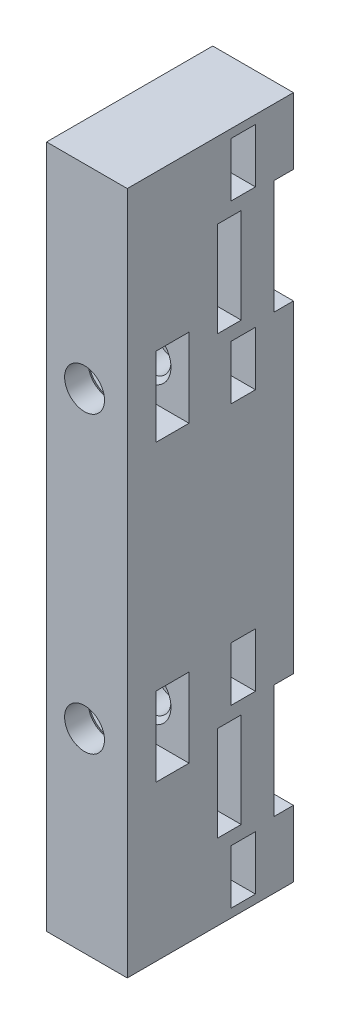
from build123d import *

# Parameters (mm, degrees)
ESQUISSE1_W             = 8.5
ESQUISSE1_H             = 72
ESQUISSE1_R             = 2.1
BOSS_EXTRU_1_DEPTH      = 17.5
ENL_V_START             = -3
ENL_V_MAT_EXTRU_4_DEPTH = 3.5
ESQUISSE7_R             = 2.1
BOSS_EXTRU_3_DEPTH      = 8
ESQUISSE3_W             = 8.5
ESQUISSE3_H             = 4
ENL_V_MAT_EXTRU_3_DEPTH = 19
BOSS_EXTRU_2_START      = -7
BOSS_EXTRU_2_DEPTH      = 12
ESQUISSE8_W             = 8.5
ESQUISSE8_H             = 7
BOSS_EXTRU_4_DEPTH      = 4
ESQUISSE9_R             = 1.6
ENL_V_MAT_EXTRU_5_DEPTH = 5
ENL_V_START_2           = -4
ESQUISSE10_R            = 1.6
ENL_V_MAT_EXTRU_6_DEPTH = 2.6
ESQUISSE11_R            = 1.6
ENL_V_MAT_EXTRU_7_DEPTH = 1.6
ESQUISSE14_W            = 2.5
ESQUISSE14_H            = 10
ENL_V_MAT_EXTRU_9_DEPTH = 17.6
CHANFREIN1_SIZE         = 0.5


with BuildPart() as part:
    # Esquisse1 → Boss.-Extru.1 (new body)
    with BuildSketch(Plane.XY):
        with Locations((4.25, 36)):
            Rectangle(ESQUISSE1_W, ESQUISSE1_H)
        with Locations((4, 20.5)):
            Circle(ESQUISSE1_R, mode=Mode.SUBTRACT)
        with Locations((4, 51.5)):
            Circle(ESQUISSE1_R, mode=Mode.SUBTRACT)
    extrude(amount=BOSS_EXTRU_1_DEPTH)

    # Esquisse6 → Enlèv. mat.-Extru.4 (cut)
    with BuildSketch(Plane.XY.offset(17.5).offset(ENL_V_START)):
        Polygon((7.6, 22.578460969), (4, 24.656921938), (0.4, 22.578460969), (0.4, 18.421539031), (4, 16.343078062), (7.6, 18.421539031), align=None)
        Polygon((8.5, 24.656921938), (4, 24.656921938), (7.6, 22.578460969), (7.6, 18.421539031), (4, 16.343078062), (8.5, 16.343078062), align=None)
    enl_v_mat_extru_4 = extrude(amount=-ENL_V_MAT_EXTRU_4_DEPTH, mode=Mode.SUBTRACT)

    # Esquisse7 → Boss.-Extru.3 (add)
    with BuildSketch(Plane(origin=(0, 0, 0), x_dir=(-1, 0, 0), z_dir=(0, 0, -1))):
        with Locations((-4, 20.5)):
            Circle(ESQUISSE7_R)
    boss_extru_3 = extrude(amount=-BOSS_EXTRU_3_DEPTH)

    # Esquisse3 → Enlèv. mat.-Extru.3 (cut)
    with BuildSketch(Plane(origin=(0, 0, 0), x_dir=(-1, 0, 0), z_dir=(0, -1, 0))):
        with Locations((-4.25, -2)):
            Rectangle(ESQUISSE3_W, ESQUISSE3_H)
    enl_v_mat_extru_3 = extrude(amount=-ENL_V_MAT_EXTRU_3_DEPTH, mode=Mode.SUBTRACT)

    # Esquisse5 → Boss.-Extru.2 (add)
    with BuildSketch(Plane.XZ.offset(BOSS_EXTRU_2_START)):
        with BuildLine():
            ThreePointArc((4.662966643, 2.165487935), (4.682946936, 2.27184931), (4.714353535, 2.375413685))
            ThreePointArc((4.714353535, 2.375413685), (5.229781903, 2.78475984), (5.773646598, 2.414028307))
            ThreePointArc((5.773646598, 2.414028307), (5.814751932, 2.291920009), (5.839789089, 2.165534781))
            ThreePointArc((5.839789089, 2.165534781), (5.889607538, 2.072347427), (5.988503907, 2.035128225))
            Line((5.988503907, 2.035128225), (6.514258005, 2.035128225))
            ThreePointArc((6.514258005, 2.035128225), (6.613136609, 2.072331852), (6.662966643, 2.165487935))
            ThreePointArc((6.662966643, 2.165487935), (6.682946936, 2.27184931), (6.714353535, 2.375413685))
            ThreePointArc((6.714353535, 2.375413685), (7.229781903, 2.78475984), (7.773646598, 2.414028307))
            ThreePointArc((7.773646598, 2.414028307), (7.814751932, 2.291920009), (7.839789089, 2.165534781))
            ThreePointArc((7.839789089, 2.165534781), (7.889607538, 2.072347427), (7.988503907, 2.035128225))
            Line((7.988503907, 2.035128225), (8.5, 2.035128225))
            Line((8.5, 2.035128225), (8.5, 4))
            Line((8.5, 4), (0, 4))
            Line((0, 4), (0, 2.035128225))
            Line((0, 2.035128225), (0.514258005, 2.035128225))
            ThreePointArc((0.514258005, 2.035128225), (0.61313661, 2.072331853), (0.662966644, 2.165487937))
            ThreePointArc((0.662966644, 2.165487937), (0.682946936, 2.271849312), (0.714353535, 2.375413685))
            ThreePointArc((0.714353535, 2.375413685), (1.229781903, 2.78475984), (1.773646598, 2.414028307))
            ThreePointArc((1.773646598, 2.414028307), (1.814751932, 2.291920009), (1.839789089, 2.165534781))
            ThreePointArc((1.839789089, 2.165534781), (1.889607538, 2.072347427), (1.988503907, 2.035128225))
            Line((1.988503907, 2.035128225), (2.514258006, 2.035128225))
            ThreePointArc((2.514258006, 2.035128225), (2.613136611, 2.072331854), (2.662966644, 2.16548794))
            ThreePointArc((2.662966644, 2.16548794), (2.682946936, 2.271849313), (2.714353535, 2.375413685))
            ThreePointArc((2.714353535, 2.375413685), (3.229781903, 2.78475984), (3.773646598, 2.414028307))
            ThreePointArc((3.773646598, 2.414028307), (3.814751932, 2.291920009), (3.839789089, 2.165534781))
            ThreePointArc((3.839789089, 2.165534781), (3.889607538, 2.072347427), (3.988503907, 2.035128225))
            Line((3.988503907, 2.035128225), (4.514258005, 2.035128225))
            ThreePointArc((4.514258005, 2.035128225), (4.613136609, 2.072331852), (4.662966643, 2.165487935))
        make_face()
    boss_extru_2 = extrude(amount=-BOSS_EXTRU_2_DEPTH)

    # Esquisse8 → Boss.-Extru.4 (add)
    with BuildSketch(Plane(origin=(0, 0, 4), x_dir=(-1, 0, 0), z_dir=(0, 0, -1))):
        with Locations((-4.25, 3.5)):
            Rectangle(ESQUISSE8_W, ESQUISSE8_H)
    boss_extru_4 = extrude(amount=BOSS_EXTRU_4_DEPTH)

    # Esquisse9 → Enlèv. mat.-Extru.5 (cut)
    with BuildSketch(Plane(origin=(0, 0, 0), x_dir=(-1, 0, 0), z_dir=(0, 0, -1))):
        with Locations((-4.25, 3.75)):
            Circle(ESQUISSE9_R)
        with Locations((-4.25, 22.25)):
            Circle(ESQUISSE9_R)
    enl_v_mat_extru_5 = extrude(amount=-ENL_V_MAT_EXTRU_5_DEPTH, mode=Mode.SUBTRACT)

    # Esquisse10 → Enlèv. mat.-Extru.6 (cut)
    # profile 1 of 4: a face of its own
    with BuildSketch(Plane(origin=(0, 0, 0), x_dir=(-1, 0, 0), z_dir=(0, 0, -1)).offset(ENL_V_START_2)):
        Polygon((-2.604551733, 25.1), (-5.895448267, 25.1), (-7.540896534, 22.25), (-5.895448267, 19.4), (-2.604551733, 19.4), (-0.959103466, 22.25), align=None)
        with Locations((-4.25, 22.25)):
            Circle(ESQUISSE10_R, mode=Mode.SUBTRACT)
    # profile 2 of 4: a face of its own
    with BuildSketch(Plane(origin=(0, 0, 0), x_dir=(-1, 0, 0), z_dir=(0, 0, -1)).offset(ENL_V_START_2)):
        Polygon((-2.604551733, 6.6), (-5.895448267, 6.6), (-7.540896534, 3.75), (-5.895448267, 0.9), (-2.604551733, 0.9), (-0.959103466, 3.75), align=None)
    # profile 3 of 4: a face of its own
    with BuildSketch(Plane(origin=(0, 0, 0), x_dir=(-1, 0, 0), z_dir=(0, 0, -1)).offset(ENL_V_START_2)):
        Polygon((-8.5, 6.6), (-5.895448267, 6.6), (-7.540896534, 3.75), (-5.895448267, 0.9), (-8.5, 0.9), align=None)
    # profile 4 of 4: a face of its own
    with BuildSketch(Plane(origin=(0, 0, 0), x_dir=(-1, 0, 0), z_dir=(0, 0, -1)).offset(ENL_V_START_2)):
        Polygon((-7.540896534, 22.25), (-5.895448267, 25.1), (-8.5, 25.1), (-8.5, 19.4), (-5.895448267, 19.4), align=None)
    enl_v_mat_extru_6 = extrude(amount=-ENL_V_MAT_EXTRU_6_DEPTH, mode=Mode.SUBTRACT)

    # Esquisse11 → Enlèv. mat.-Extru.7 (cut)
    with BuildSketch(Plane(origin=(0, 0, 5), x_dir=(-1, 0, 0), z_dir=(0, 0, -1))):
        with Locations((-4.25, 22.25)):
            Circle(ESQUISSE11_R)
    enl_v_mat_extru_7 = extrude(amount=-ENL_V_MAT_EXTRU_7_DEPTH, mode=Mode.SUBTRACT)

    # Esquisse14 → Enlèv. mat.-Extru.9 (cut)
    with BuildSketch(Plane(origin=(8.5, 0, 0), x_dir=(0, 0, -1), z_dir=(1, 0, 0))):
        with Locations((-6.75, 13)):
            Rectangle(ESQUISSE14_W, ESQUISSE14_H)
    enl_v_mat_extru_9 = extrude(amount=-ENL_V_MAT_EXTRU_9_DEPTH, mode=Mode.SUBTRACT)

    # Symétrie14: Enlèv. mat.-Extru.4, Boss.-Extru.3, Enlèv. mat.-Extru.3, Boss.-Extru.2, Boss.-Extru.4, Enlèv. mat.-Extru.5, Enlèv. mat.-Extru.6, Enlèv. mat.-Extru.7, Enlèv. mat.-Extru.9 across plane
    add(enl_v_mat_extru_4.mirror(Plane(origin=(0, 36, 0), x_dir=(0, 0, 1), z_dir=(0, -1, 0))), mode=Mode.SUBTRACT)
    add(boss_extru_3.mirror(Plane(origin=(0, 36, 0), x_dir=(0, 0, 1), z_dir=(0, -1, 0))))
    add(enl_v_mat_extru_3.mirror(Plane(origin=(0, 36, 0), x_dir=(0, 0, 1), z_dir=(0, -1, 0))), mode=Mode.SUBTRACT)
    add(boss_extru_2.mirror(Plane(origin=(0, 36, 0), x_dir=(0, 0, 1), z_dir=(0, -1, 0))))
    add(boss_extru_4.mirror(Plane(origin=(0, 36, 0), x_dir=(0, 0, 1), z_dir=(0, -1, 0))))
    add(enl_v_mat_extru_5.mirror(Plane(origin=(0, 36, 0), x_dir=(0, 0, 1), z_dir=(0, -1, 0))), mode=Mode.SUBTRACT)
    add(enl_v_mat_extru_6.mirror(Plane(origin=(0, 36, 0), x_dir=(0, 0, 1), z_dir=(0, -1, 0))), mode=Mode.SUBTRACT)
    add(enl_v_mat_extru_7.mirror(Plane(origin=(0, 36, 0), x_dir=(0, 0, 1), z_dir=(0, -1, 0))), mode=Mode.SUBTRACT)
    add(enl_v_mat_extru_9.mirror(Plane(origin=(0, 36, 0), x_dir=(0, 0, 1), z_dir=(0, -1, 0))), mode=Mode.SUBTRACT)

    # Chanfrein1
    chanfrein1_edges = [part.edges().sort_by_distance(p)[0] for p in [
        (1.9, 51.5, 14.5),
        (1.9, 51.5, 11),
        (1.9, 20.5, 11),
        (1.9, 20.5, 14.5),
    ]]
    chamfer(chanfrein1_edges, length=CHANFREIN1_SIZE)


solid = part.part
